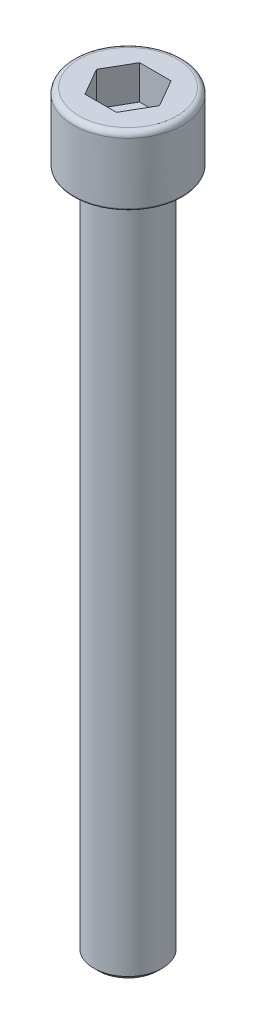
from build123d import *

# Parameters (mm, degrees)
CUT_EXTRUDE1_DEPTH = 5
FILLET3_R          = 0.8
CHAMFER1_SIZE      = 0.625
FILLET4_R          = 0.25


with BuildPart() as part:
    # Sketch1 → Revolve1 (revolve)
    with BuildSketch(Plane.XY, mode=Mode.PRIVATE) as revolve1_sk:
        Polygon((0, 0), (8, 0), (8, -10), (5, -10), (5, -110), (0, -110), align=None)
    revolve(revolve1_sk.sketch.rotate(Axis((0, -115, 0), (0, 1, 0)), 90), axis=Axis((0, -115, 0), (0, 1, 0)))

    # Sketch2 → Cut-Extrude1 (cut)
    with BuildSketch(Plane(origin=(0, 0, 0), x_dir=(1, 0, 0), z_dir=(0, 1, 0))):
        Polygon((4.618802154, 0), (2.309401077, 4), (-2.309401077, 4), (-4.618802154, 0), (-2.309401077, -4), (2.309401077, -4), align=None)
    extrude(amount=-CUT_EXTRUDE1_DEPTH, mode=Mode.SUBTRACT)

    # Fillet3
    fillet3_edges = [part.edges().sort_by_distance(p)[0] for p in [
        (0, 0, 8),
    ]]
    fillet(fillet3_edges, radius=FILLET3_R)

    # Chamfer1
    chamfer1_edges = [part.edges().sort_by_distance(p)[0] for p in [
        (0, -110, 5),
    ]]
    chamfer(chamfer1_edges, length=CHAMFER1_SIZE)

    # Fillet4
    fillet4_edges = [part.edges().sort_by_distance(p)[0] for p in [
        (0, -10, 5),
        (0, -10, 8),
    ]]
    fillet(fillet4_edges, radius=FILLET4_R)


solid = part.part
